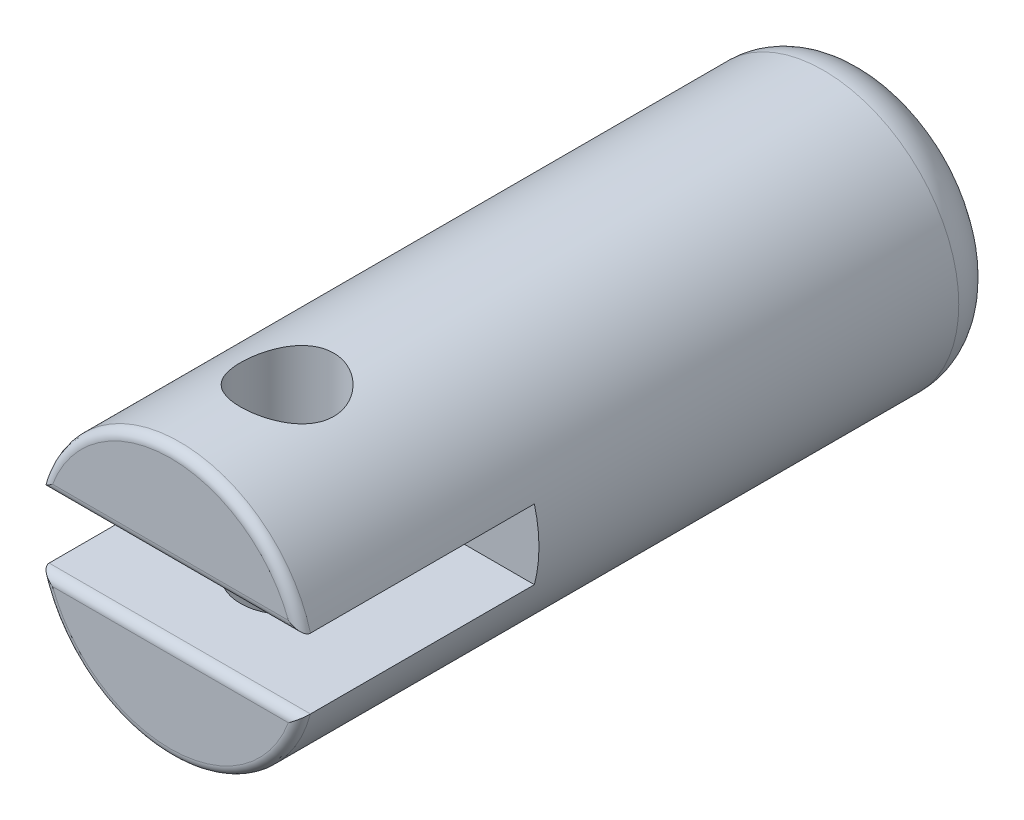
from build123d import *

# Parameters (mm, degrees)
SKETCH1_R               = 2.9
BOSS_EXTRUDE1_DEPTH     = 15
FILLET2_R               = 1
SKETCH2_W               = 5.8
SKETCH2_H               = 5
CUT_EXTRUDE1_DEPTH      = 0.75
CUT_EXTRUDE2_DEPTH      = 16.550562691
CUT_EXTRUDE2_DEPTH_BACK = 16.550562691
SKETCH2_3_R             = 1
FILLET4_R               = 0.2


with BuildPart() as part:
    # Sketch1 → Boss-Extrude1 (new body)
    with BuildSketch(Plane.XY):
        Circle(SKETCH1_R)
    extrude(amount=BOSS_EXTRUDE1_DEPTH)

    # Fillet2
    fillet2_edges = [part.edges().sort_by_distance(p)[0] for p in [
        (-2.9, 0, 0),
    ]]
    fillet(fillet2_edges, radius=FILLET2_R)

    # Sketch2 → Cut-Extrude1 (cut, symmetric)
    with BuildSketch(Plane(origin=(0, 0, 0), x_dir=(1, 0, 0), z_dir=(0, 1, 0))):
        with Locations((0, -12.5)):
            Rectangle(SKETCH2_W, SKETCH2_H)
    extrude(amount=CUT_EXTRUDE1_DEPTH, both=True, mode=Mode.SUBTRACT)

    # Sketch2<3> → Cut-Extrude2 (cut, two sides: drawn at the far end of the back side and taken through both)
    with BuildSketch(Plane(origin=(0, 0, 0), x_dir=(1, 0, 0), z_dir=(0, 1, 0)).offset(-CUT_EXTRUDE2_DEPTH_BACK)):
        with Locations((0, -12.5)):
            Circle(SKETCH2_3_R)
    extrude(amount=CUT_EXTRUDE2_DEPTH + CUT_EXTRUDE2_DEPTH_BACK, mode=Mode.SUBTRACT)

    # Fillet4
    fillet4_edges = [part.edges().sort_by_distance(p)[0] for p in [
        (0, -0.75, 15),
        (0, -2.9, 15),
        (0, 2.9, 15),
        (0, 0.75, 15),
    ]]
    fillet(fillet4_edges, radius=FILLET4_R)


solid = part.part
